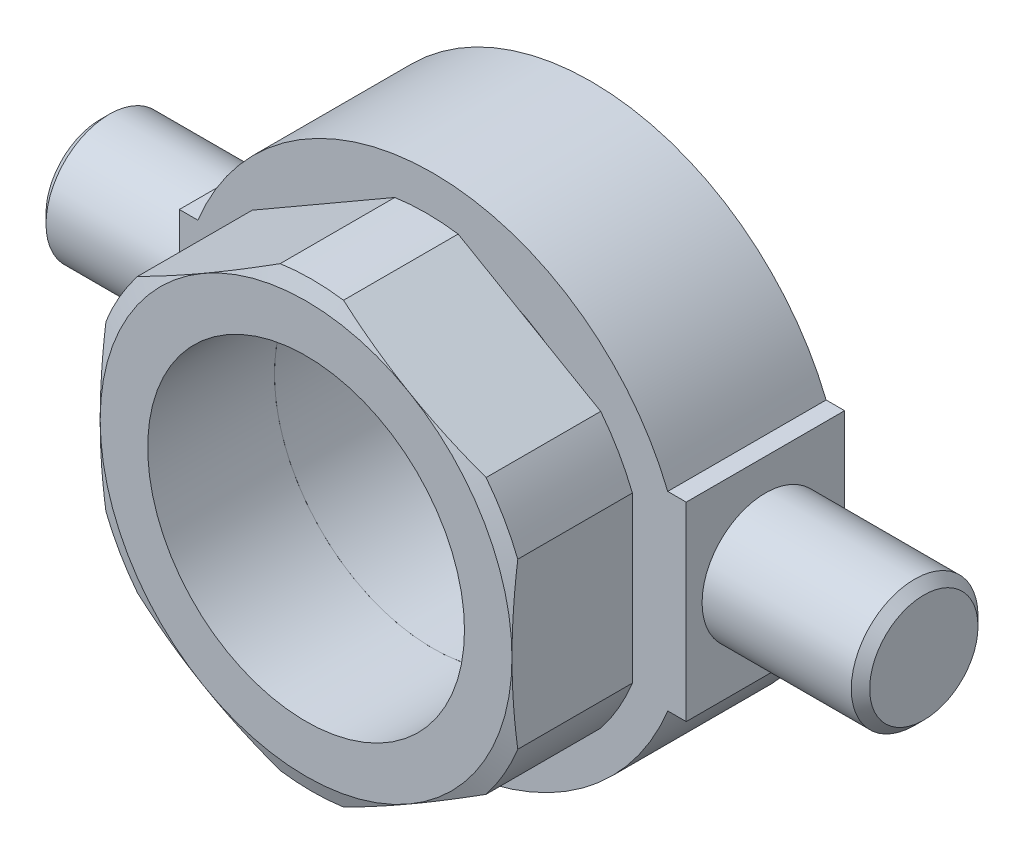
from build123d import *

# Parameters (mm, degrees)
EXTRUDE_1_DEPTH     = 10
SKETCH_3_R          = 4
EXTRUDE_2_DEPTH     = 10
EXTRUDE_3_DEPTH     = 8
SKETCH_6_R          = 15.011106999
SKETCH_6_R_2        = 12.5
CUT_EXTRUDE_1_DEPTH = 0.4
SKETCH_7_OUTSIDE_W  = 66.732
SKETCH_7_OUTSIDE_H  = 46.732
SKETCH_7_OUTSIDE_R  = 14
CUT_EXTRUDE_2_DEPTH = 8
SKETCH_8_R          = 10
CUT_EXTRUDE_3_DEPTH = 36.440090293
SKETCH_9_R          = 10
CUT_EXTRUDE_4_DEPTH = 36.440090293
CHAMFER_1_SIZE      = 0.58


with BuildPart() as part:
    # 草图2 → 凸台-拉伸1 (new body)
    with BuildSketch(Plane.XY):
        with BuildLine():
            Line((-16, 6), (-16, -6))
            Line((-16, -6), (-14.832396974, -6))
            ThreePointArc((-14.832396974, -6), (0, -16), (14.832396974, -6))
            Line((14.832396974, -6), (16, -6))
            Line((16, -6), (16, 6))
            Line((16, 6), (14.832396974, 6))
            ThreePointArc((14.832396974, 6), (0, 16), (-14.832396974, 6))
            Line((-14.832396974, 6), (-16, 6))
        make_face()
    extrude(amount=EXTRUDE_1_DEPTH)

    # 草图3 → 凸台-拉伸2 (add)
    with BuildSketch(Plane.ZY.offset(16)):
        with Locations(Location((5, 0, 0), (0, 0, 180))):
            Circle(SKETCH_3_R)
    extrude_2 = extrude(amount=EXTRUDE_2_DEPTH)

    # 镜向1: 凸台-拉伸2 across plane
    add(extrude_2.mirror(Plane(origin=(0, 0, 0), x_dir=(0, 0, 1), z_dir=(1, 0, 0))))

    # 草图8 → 切除-拉伸3 (cut, through all)
    with BuildSketch(Plane(origin=(0, 0, 0), x_dir=(-1, 0, 0), z_dir=(0, 0, -1))):
        Circle(SKETCH_8_R)
    extrude(amount=-CUT_EXTRUDE_3_DEPTH, mode=Mode.SUBTRACT)

    # 倒角1
    chamfer_1_edges = [part.edges().sort_by_distance(p)[0] for p in [
        (-26, 0, 9),
        (26, 0, 9),
    ]]
    chamfer(chamfer_1_edges, length=CHAMFER_1_SIZE)


with BuildPart() as body_2:
    # 草图4 → 凸台-拉伸3 (new body)
    with BuildSketch(Plane.XY.offset(10)):
        Polygon((13, 7.505553499), (0, 15.011106999), (-13, 7.505553499), (-13, -7.505553499), (0, -15.011106999), (13, -7.505553499), align=None)
    extrude(amount=EXTRUDE_3_DEPTH)

    # 草图5 → 切除-旋转1 (revolve, cut)
    with BuildSketch(Plane(origin=(0, 0, 0), x_dir=(1, 0, 0), z_dir=(0, 1, 0))):
        Polygon((-13, -18), (-23.989909678, -18), (-23.989909678, -14), align=None)
    revolve(axis=Axis((0, 0, 10), (0, 0, -1)), mode=Mode.SUBTRACT)

    # 草图6 → 切除-拉伸1 (cut)
    with BuildSketch(Plane.XY.offset(10)):
        Circle(SKETCH_6_R)
        Circle(SKETCH_6_R_2, mode=Mode.SUBTRACT)
    extrude(amount=CUT_EXTRUDE_1_DEPTH, mode=Mode.SUBTRACT)

    # 草图7 outside → 切除-拉伸2 (cut)
    with BuildSketch(Plane(origin=(0, 0, 18), x_dir=(-1, 0, 0), z_dir=(0, 0, -1))):
        Rectangle(SKETCH_7_OUTSIDE_W, SKETCH_7_OUTSIDE_H)
        Circle(SKETCH_7_OUTSIDE_R, mode=Mode.SUBTRACT)
    extrude(amount=CUT_EXTRUDE_2_DEPTH, mode=Mode.SUBTRACT)

    # 草图9 → 切除-拉伸4 (cut, through all)
    with BuildSketch(Plane.XY.offset(18)):
        Circle(SKETCH_9_R)
    extrude(amount=-CUT_EXTRUDE_4_DEPTH, mode=Mode.SUBTRACT)


solid = Compound([part.part, body_2.part])
